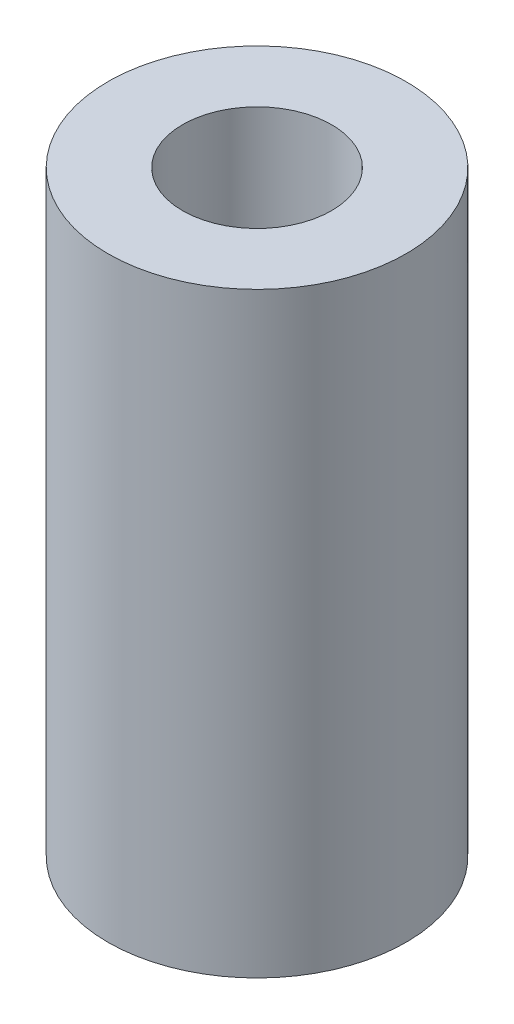
from build123d import *

# Parameters (mm, degrees)
SKETCH1_R           = 2.54
SKETCH1_R_2         = 1.27
BOSS_EXTRUDE1_DEPTH = 5.08


with BuildPart() as part:
    # Sketch1 → Boss-Extrude1 (new, symmetric)
    with BuildSketch(Plane(origin=(0, 0, 0), x_dir=(1, 0, 0), z_dir=(0, 1, 0))):
        with Locations(Location((0, 0, 0), (0, 0, 270))):
            Circle(SKETCH1_R)
        with Locations(Location((0, 0, 0), (0, 0, 270))):
            Circle(SKETCH1_R_2, mode=Mode.SUBTRACT)
    extrude(amount=BOSS_EXTRUDE1_DEPTH, both=True)


solid = part.part
